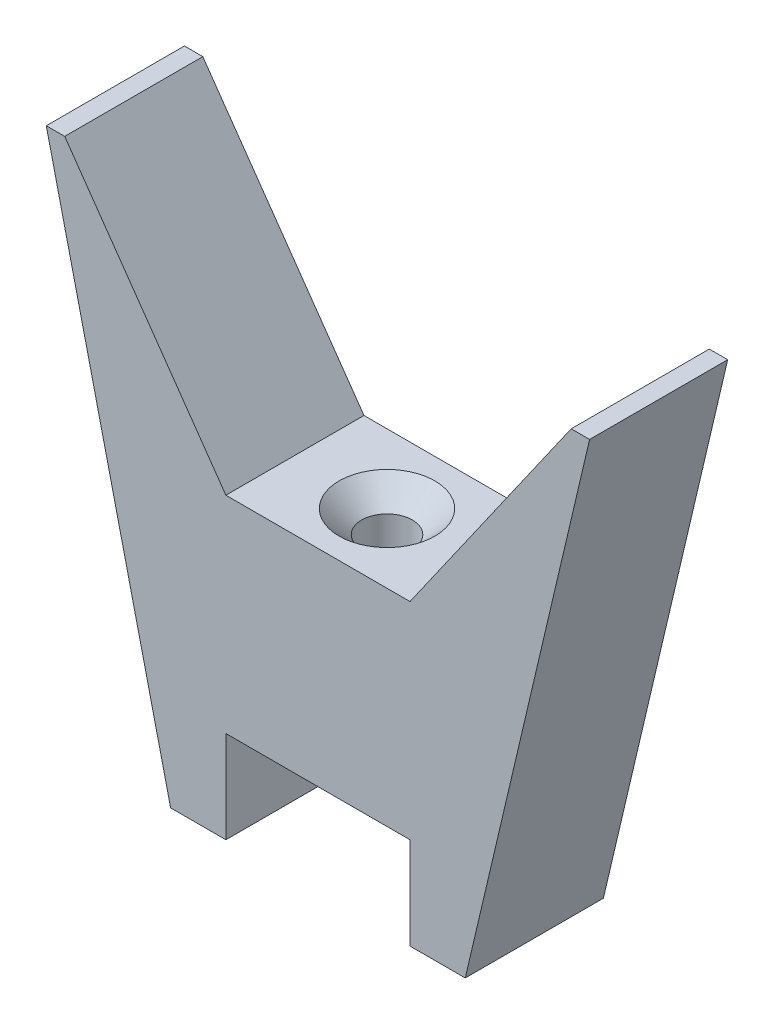
from build123d import *

# Parameters (mm, degrees)
EXTRUDE_1_DEPTH             = 7.5
HOLE_WIZARD_M51_D           = 5.5
HOLE_WIZARD_M51_CSINK_D     = 10.4
HOLE_WIZARD_M51_CSINK_ANGLE = 90


with BuildPart() as part:
    # Эскиз1 → Бобышка-Вытянуть1 (new, symmetric)
    with BuildSketch(Plane.XY):
        Polygon((-10, 0), (-10, 10), (10, 10), (10, 0), (16, 0), (29.505188455, 57.41043399), (27.505188455, 57.41043399), (10, 32.41043399), (-10, 32.41043399), (-27.505188455, 57.41043399), (-29.505188455, 57.41043399), (-16, 0), align=None)
    extrude(amount=EXTRUDE_1_DEPTH, both=True)

    # Зенковка для  винта с плоской головкой M51 (through all)
    with Locations(Plane.ZX.offset(32.41043399)):
        with Locations((0, 0)):
            CounterSinkHole(HOLE_WIZARD_M51_D / 2, HOLE_WIZARD_M51_CSINK_D / 2, counter_sink_angle=HOLE_WIZARD_M51_CSINK_ANGLE)


solid = part.part
